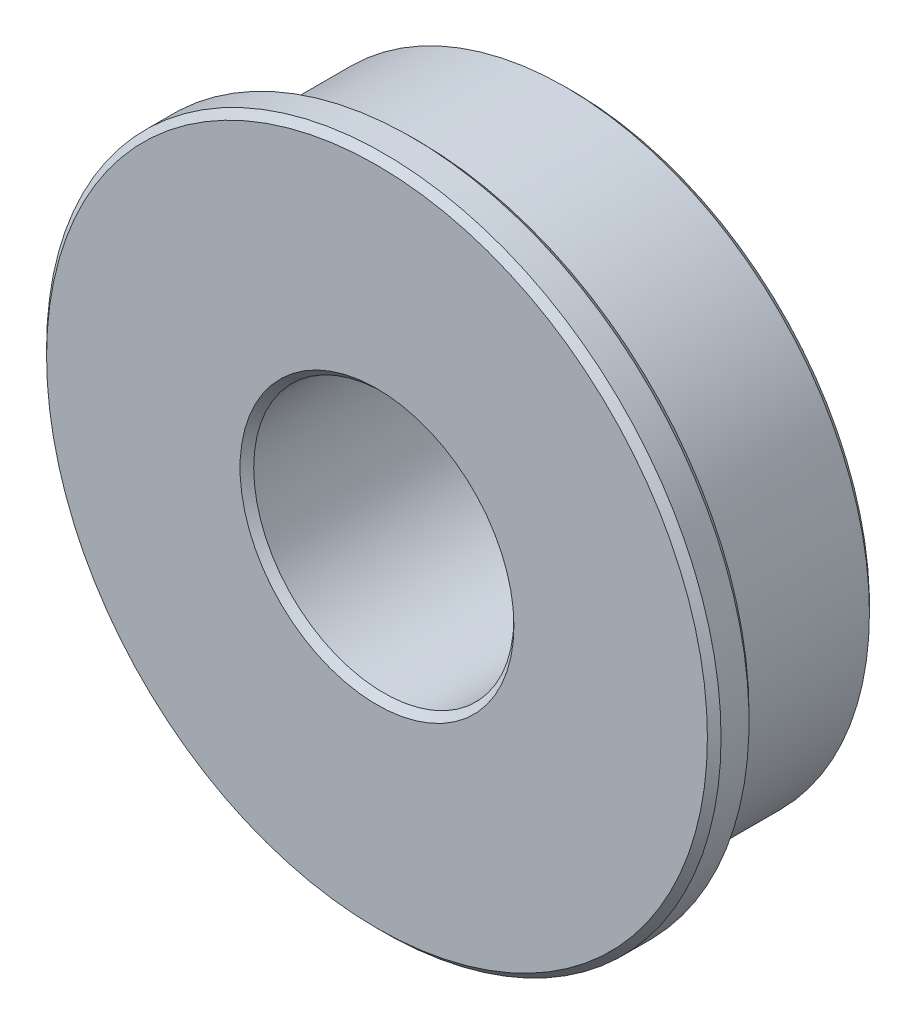
from build123d import *

# Parameters (mm, degrees)
CHAMFER1_SIZE = 0.25


with BuildPart() as part:
    # Sketch2 → Revolve1 (revolve)
    with BuildSketch(Plane(origin=(0, 0, 0), x_dir=(1, 0, 0), z_dir=(0, 1, 0))):
        Polygon((-4.762498993, -2.9131e-05), (-11.112498283, -2.9131e-05), (-11.112498283, -5.638830007), (-12.344399539, -5.638830007), (-12.344399539, -7.162829152), (-4.762498993, -7.162829152), align=None)
    revolve(axis=Axis((0, 0, 0), (0, 0, 1)))

    # Chamfer1
    chamfer1_edges = [part.edges().sort_by_distance(p)[0] for p in [
        (11.112498283, 0, 2.9131e-05),
        (4.762498993, 0, 2.9131e-05),
        (4.762498993, 0, 7.162829152),
        (12.344399539, 0, 7.162829152),
        (12.344399539, 0, 5.638830007),
    ]]
    chamfer(chamfer1_edges, length=CHAMFER1_SIZE)


solid = part.part
